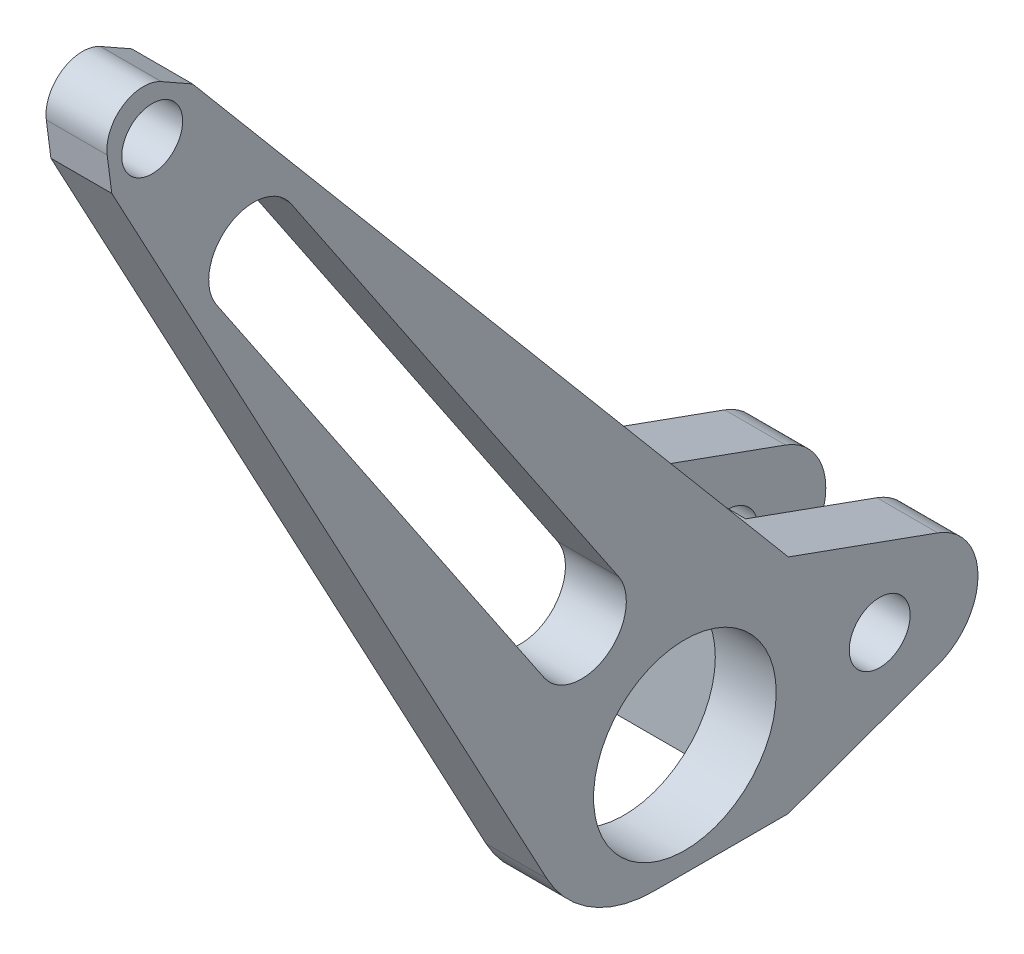
from build123d import *

# Parameters (mm, degrees)
SKETCH_1_R      = 15
SKETCH_1_R_2    = 5
EXTRUDE_1_DEPTH = 10
EXTRUDE_2_DEPTH = 25
EXTRUDE_START   = 25
SKETCH_4_R      = 5
EXTRUDE_3_DEPTH = 10


with BuildPart() as part:
    # 草图1 → 凸台-拉伸1 (new body)
    with BuildSketch(Plane(origin=(0, 0, 0), x_dir=(0, 0, -1), z_dir=(1, 0, 0))):
        with BuildLine():
            Line((17, -18.250593409), (-5.033226664, -18.250593409))
            ThreePointArc((-5.033226664, -18.250593409), (-15.302169006, -15.413018156), (-22.657221681, -7.705475727))
            Line((-22.657221681, -7.705475727), (-94.136701981, 125.532989051))
            Line((-94.136701981, 125.532989051), (-94.892932848, 131.372771855))
            ThreePointArc((-94.892932848, 131.372771855), (-92.292875006, 137.120842866), (-85.988862782, 137.365895938))
            Line((-85.988862782, 137.365895938), (-80.863298019, 134.467010949))
            Line((-80.863298019, 134.467010949), (17, 18.250593409))
            Line((17, 18.250593409), (41.539406806, 9.407825134))
            ThreePointArc((41.539406806, 9.407825134), (48.14929969, 0), (41.539406806, -9.407825134))
            Line((41.539406806, -9.407825134), (17, -18.250593409))
        make_face()
        Circle(SKETCH_1_R, mode=Mode.SUBTRACT)
        with Locations((-87.5, 130)):
            Circle(SKETCH_1_R_2, mode=Mode.SUBTRACT)
        with Locations((32, 0)):
            Circle(SKETCH_1_R_2, mode=Mode.SUBTRACT)
        with BuildLine():
            Line((-64.708700169, 109.357968665), (-10.87651369, 29.378720182))
            ThreePointArc((-10.87651369, 29.378720182), (-12.878422676, 19.133656547), (-23.12348631, 21.135565533))
            Line((-23.12348631, 21.135565533), (-76.95567279, 101.114814016))
            ThreePointArc((-76.95567279, 101.114814016), (-74.953763803, 111.359877651), (-64.708700169, 109.357968665))
        make_face(mode=Mode.SUBTRACT)
    extrude(amount=EXTRUDE_1_DEPTH)

    # 草图2 → 凸台-拉伸2 (add)
    with BuildSketch(Plane(origin=(0, 0, 0), x_dir=(0, 0, -1), z_dir=(1, 0, 0))):
        Polygon((17, 18.250593409), (17, -18.250593409), (20, -17.169544261), (20, 17.169544261), align=None)
    extrude(amount=-EXTRUDE_2_DEPTH)

    # 草图4 → 凸台-拉伸3 (add)
    with BuildSketch(Plane.ZY.offset(EXTRUDE_START)):
        with BuildLine():
            ThreePointArc((-41.539406806, 9.407825134), (-48.14929969, 0), (-41.539406806, -9.407825134))
            Line((-41.539406806, -9.407825134), (-20, -17.169544261))
            Line((-20, -17.169544261), (-20, 17.169544261))
            Line((-20, 17.169544261), (-41.539406806, 9.407825134))
        make_face()
        with Locations((-32, 0)):
            Circle(SKETCH_4_R, mode=Mode.SUBTRACT)
    extrude(amount=-EXTRUDE_3_DEPTH)


solid = part.part
